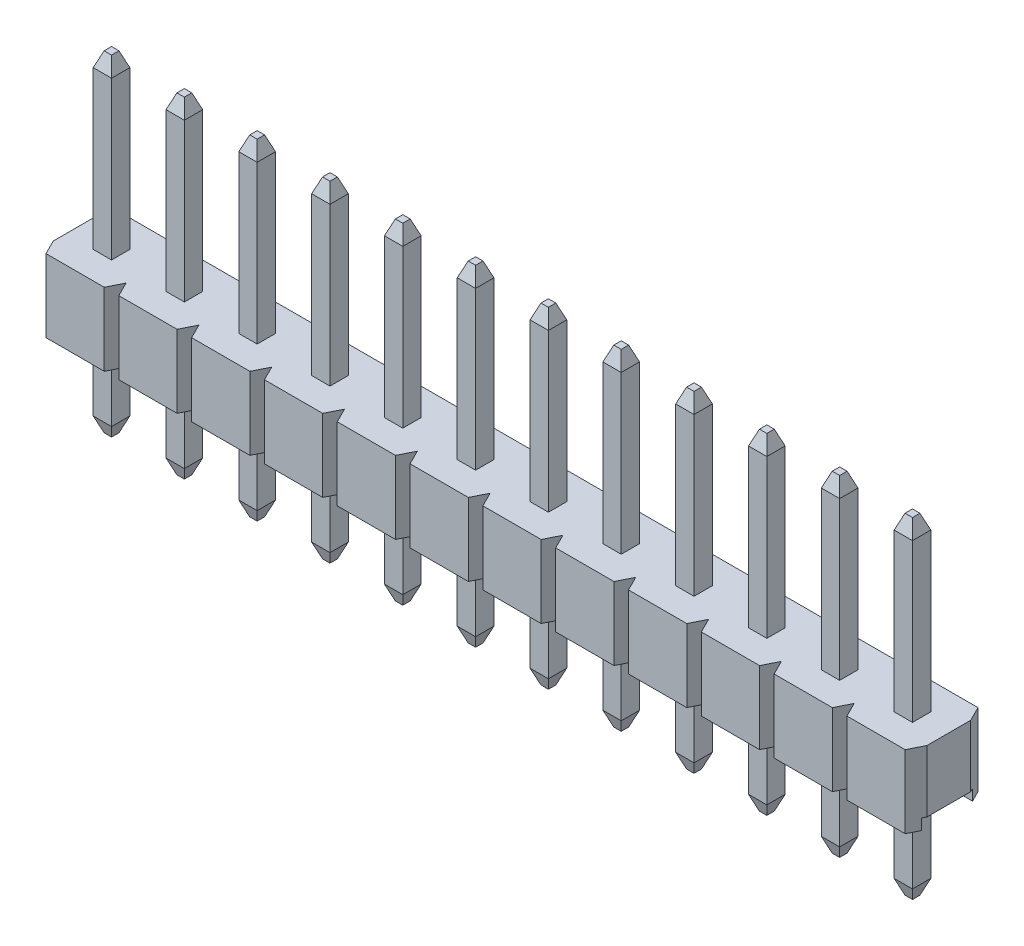
from build123d import *
from OCP.BRepFilletAPI import BRepFilletAPI_MakeChamfer

# Parameters (mm, degrees)
SKETCH1_W                     = 2.54
SKETCH1_H                     = 2.54
MAIN_BODY_DEPTH               = 2.54
SKETCH3_W                     = 1.778
SKETCH3_H                     = 0.381
CUT_EXTRUDE1_DEPTH            = 5.399409051
CUT_EXTRUDE2_DEPTH            = 5.399409051
BODY_PATTERN_COUNT            = 12
BODY_PATTERN_PITCH            = 2.54
PIN_START                     = -5.54
SKETCH2_W                     = 0.64
SKETCH2_H                     = 0.64
PIN_DEPTH                     = 11.54
CHAMFER1_SIZE                 = 0.508
CHAMFER1_SIZE2                = 0.1905
CHAMFER2_SIZE                 = 0.1905
CHAMFER2_SIZE2                = 0.508
PIN_PATTERN_COUNT             = 12
PIN_PATTERN_PITCH             = 2.54
CHAMFER1_OF_PIN_PATTERN_SIZE  = 0.508
CHAMFER1_OF_PIN_PATTERN_SIZE2 = 0.1905
CHAMFER2_OF_PIN_PATTERN_SIZE2 = 0.1905
CHAMFER2_OF_PIN_PATTERN_SIZE  = 0.508


with BuildPart() as part:
    # Sketch1 → Main Body (new body)
    with BuildSketch(Plane(origin=(0, 0, 0), x_dir=(1, 0, 0), z_dir=(0, 1, 0))):
        with Locations((1.27, 1.27)):
            Rectangle(SKETCH1_W, SKETCH1_H)
    main_body = extrude(amount=MAIN_BODY_DEPTH)

    # Sketch3 → Cut-Extrude1 (cut, through all)
    with BuildSketch(Plane.ZY):
        with Locations((-1.27, 0.1905)):
            Rectangle(SKETCH3_W, SKETCH3_H)
    cut_extrude1 = extrude(amount=-CUT_EXTRUDE1_DEPTH, mode=Mode.SUBTRACT)

    # Sketch4 → Cut-Extrude2 (cut, through all)
    with BuildSketch(Plane(origin=(0, 2.54, 0), x_dir=(1, 0, 0), z_dir=(0, 1, 0))):
        Polygon((0.254, 2.54), (0, 2.54), (0, 2.032), align=None)
        Polygon((2.54, 2.54), (2.286, 2.54), (2.54, 2.032), align=None)
        Polygon((0.254, 0), (0, 0.508), (0, 0), align=None)
        Polygon((2.54, 0), (2.286, 0), (2.54, 0.508), align=None)
    cut_extrude2 = extrude(amount=-CUT_EXTRUDE2_DEPTH, mode=Mode.SUBTRACT)

    # Body Pattern: Main Body, Cut-Extrude1, Cut-Extrude2 ×12
    with Locations(*[(-i * BODY_PATTERN_PITCH, 0, 0) for i in range(1, BODY_PATTERN_COUNT)]):
        add(main_body)
        add(cut_extrude1, mode=Mode.SUBTRACT)
        add(cut_extrude2, mode=Mode.SUBTRACT)

    # Sketch2 → Pin (add)
    with BuildSketch(Plane(origin=(0, 2.54, 0), x_dir=(1, 0, 0), z_dir=(0, 1, 0)).offset(PIN_START)):
        with Locations((1.27, 1.27)):
            Rectangle(SKETCH2_W, SKETCH2_H)
    pin = extrude(amount=PIN_DEPTH)

    # Chamfer1: one chamfer whose edges measure the first distance from different faces: ONE call of the kernel's chamfer builder (chamfer() names one face for all edges)
    chamfer1_edges_1 = [part.edges().sort_by_distance(p)[0] for p in [
        (0.95, 8.54, -1.27),
    ]]
    chamfer1_side_1 = [part.faces().sort_by_distance(p)[0] for p in [
        (0.95, 5.54, -1.27),
    ]]
    chamfer1_edges_2 = [part.edges().sort_by_distance(p)[0] for p in [
        (1.27, 8.54, -0.95),
    ]]
    chamfer1_side_2 = [part.faces().sort_by_distance(p)[0] for p in [
        (1.27, 5.54, -0.95),
    ]]
    chamfer1_edges_3 = [part.edges().sort_by_distance(p)[0] for p in [
        (1.59, 8.54, -1.27),
    ]]
    chamfer1_side_3 = [part.faces().sort_by_distance(p)[0] for p in [
        (1.59, 5.54, -1.27),
    ]]
    chamfer1_edges_4 = [part.edges().sort_by_distance(p)[0] for p in [
        (1.27, 8.54, -1.59),
    ]]
    chamfer1_side_4 = [part.faces().sort_by_distance(p)[0] for p in [
        (1.27, 5.54, -1.59),
    ]]
    chamfer1 = BRepFilletAPI_MakeChamfer(part.part.solid().wrapped)
    for e in chamfer1_edges_1:
        chamfer1.Add(CHAMFER1_SIZE, CHAMFER1_SIZE2, e.wrapped, chamfer1_side_1[0].wrapped)  # the first distance lies on this face
    for e in chamfer1_edges_2:
        chamfer1.Add(CHAMFER1_SIZE, CHAMFER1_SIZE2, e.wrapped, chamfer1_side_2[0].wrapped)  # the first distance lies on this face
    for e in chamfer1_edges_3:
        chamfer1.Add(CHAMFER1_SIZE, CHAMFER1_SIZE2, e.wrapped, chamfer1_side_3[0].wrapped)  # the first distance lies on this face
    for e in chamfer1_edges_4:
        chamfer1.Add(CHAMFER1_SIZE, CHAMFER1_SIZE2, e.wrapped, chamfer1_side_4[0].wrapped)  # the first distance lies on this face
    add(Compound.cast(chamfer1.Shape()), mode=Mode.REPLACE)

    # Chamfer2
    chamfer2_edges = [part.edges().sort_by_distance(p)[0] for p in [
        (1.27, -3, -0.95),
        (1.59, -3, -1.27),
        (1.27, -3, -1.59),
        (0.95, -3, -1.27),
    ]]
    chamfer2_side = [part.faces().sort_by_distance(p)[0] for p in [
        (1.27, -3, -1.27),
    ]]
    chamfer(chamfer2_edges, length=CHAMFER2_SIZE, length2=CHAMFER2_SIZE2, reference=chamfer2_side[0])

    # Pin Pattern: Pin ×12
    with Locations(*[(-i * PIN_PATTERN_PITCH, 0, 0) for i in range(1, PIN_PATTERN_COUNT)]):
        add(pin)

    # Chamfer1 of Pin Pattern: one chamfer whose edges measure the first distance from different faces: ONE call of the kernel's chamfer builder (chamfer() names one face for all edges)
    chamfer1_of_pin_pattern_edges_1 = [part.edges().sort_by_distance(p)[0] for p in [
        (-1.59, 8.54, -1.27),
    ]]
    chamfer1_of_pin_pattern_side_1 = [part.faces().sort_by_distance(p)[0] for p in [
        (-1.59, 5.54, -1.27),
    ]]
    chamfer1_of_pin_pattern_edges_2 = [part.edges().sort_by_distance(p)[0] for p in [
        (-1.27, 8.54, -0.95),
    ]]
    chamfer1_of_pin_pattern_side_2 = [part.faces().sort_by_distance(p)[0] for p in [
        (-1.27, 5.54, -0.95),
    ]]
    chamfer1_of_pin_pattern_edges_3 = [part.edges().sort_by_distance(p)[0] for p in [
        (-0.95, 8.54, -1.27),
    ]]
    chamfer1_of_pin_pattern_side_3 = [part.faces().sort_by_distance(p)[0] for p in [
        (-0.95, 5.54, -1.27),
    ]]
    chamfer1_of_pin_pattern_edges_4 = [part.edges().sort_by_distance(p)[0] for p in [
        (-1.27, 8.54, -1.59),
    ]]
    chamfer1_of_pin_pattern_side_4 = [part.faces().sort_by_distance(p)[0] for p in [
        (-1.27, 5.54, -1.59),
    ]]
    chamfer1_of_pin_pattern_edges_5 = [part.edges().sort_by_distance(p)[0] for p in [
        (-4.13, 8.54, -1.27),
    ]]
    chamfer1_of_pin_pattern_side_5 = [part.faces().sort_by_distance(p)[0] for p in [
        (-4.13, 5.54, -1.27),
    ]]
    chamfer1_of_pin_pattern_edges_6 = [part.edges().sort_by_distance(p)[0] for p in [
        (-3.81, 8.54, -0.95),
    ]]
    chamfer1_of_pin_pattern_side_6 = [part.faces().sort_by_distance(p)[0] for p in [
        (-3.81, 5.54, -0.95),
    ]]
    chamfer1_of_pin_pattern_edges_7 = [part.edges().sort_by_distance(p)[0] for p in [
        (-3.49, 8.54, -1.27),
    ]]
    chamfer1_of_pin_pattern_side_7 = [part.faces().sort_by_distance(p)[0] for p in [
        (-3.49, 5.54, -1.27),
    ]]
    chamfer1_of_pin_pattern_edges_8 = [part.edges().sort_by_distance(p)[0] for p in [
        (-3.81, 8.54, -1.59),
    ]]
    chamfer1_of_pin_pattern_side_8 = [part.faces().sort_by_distance(p)[0] for p in [
        (-3.81, 5.54, -1.59),
    ]]
    chamfer1_of_pin_pattern_edges_9 = [part.edges().sort_by_distance(p)[0] for p in [
        (-6.67, 8.54, -1.27),
    ]]
    chamfer1_of_pin_pattern_side_9 = [part.faces().sort_by_distance(p)[0] for p in [
        (-6.67, 5.54, -1.27),
    ]]
    chamfer1_of_pin_pattern_edges_10 = [part.edges().sort_by_distance(p)[0] for p in [
        (-6.35, 8.54, -0.95),
    ]]
    chamfer1_of_pin_pattern_side_10 = [part.faces().sort_by_distance(p)[0] for p in [
        (-6.35, 5.54, -0.95),
    ]]
    chamfer1_of_pin_pattern_edges_11 = [part.edges().sort_by_distance(p)[0] for p in [
        (-6.03, 8.54, -1.27),
    ]]
    chamfer1_of_pin_pattern_side_11 = [part.faces().sort_by_distance(p)[0] for p in [
        (-6.03, 5.54, -1.27),
    ]]
    chamfer1_of_pin_pattern_edges_12 = [part.edges().sort_by_distance(p)[0] for p in [
        (-6.35, 8.54, -1.59),
    ]]
    chamfer1_of_pin_pattern_side_12 = [part.faces().sort_by_distance(p)[0] for p in [
        (-6.35, 5.54, -1.59),
    ]]
    chamfer1_of_pin_pattern_edges_13 = [part.edges().sort_by_distance(p)[0] for p in [
        (-9.21, 8.54, -1.27),
    ]]
    chamfer1_of_pin_pattern_side_13 = [part.faces().sort_by_distance(p)[0] for p in [
        (-9.21, 5.54, -1.27),
    ]]
    chamfer1_of_pin_pattern_edges_14 = [part.edges().sort_by_distance(p)[0] for p in [
        (-8.89, 8.54, -0.95),
    ]]
    chamfer1_of_pin_pattern_side_14 = [part.faces().sort_by_distance(p)[0] for p in [
        (-8.89, 5.54, -0.95),
    ]]
    chamfer1_of_pin_pattern_edges_15 = [part.edges().sort_by_distance(p)[0] for p in [
        (-8.57, 8.54, -1.27),
    ]]
    chamfer1_of_pin_pattern_side_15 = [part.faces().sort_by_distance(p)[0] for p in [
        (-8.57, 5.54, -1.27),
    ]]
    chamfer1_of_pin_pattern_edges_16 = [part.edges().sort_by_distance(p)[0] for p in [
        (-8.89, 8.54, -1.59),
    ]]
    chamfer1_of_pin_pattern_side_16 = [part.faces().sort_by_distance(p)[0] for p in [
        (-8.89, 5.54, -1.59),
    ]]
    chamfer1_of_pin_pattern_edges_17 = [part.edges().sort_by_distance(p)[0] for p in [
        (-11.75, 8.54, -1.27),
    ]]
    chamfer1_of_pin_pattern_side_17 = [part.faces().sort_by_distance(p)[0] for p in [
        (-11.75, 5.54, -1.27),
    ]]
    chamfer1_of_pin_pattern_edges_18 = [part.edges().sort_by_distance(p)[0] for p in [
        (-11.43, 8.54, -0.95),
    ]]
    chamfer1_of_pin_pattern_side_18 = [part.faces().sort_by_distance(p)[0] for p in [
        (-11.43, 5.54, -0.95),
    ]]
    chamfer1_of_pin_pattern_edges_19 = [part.edges().sort_by_distance(p)[0] for p in [
        (-11.11, 8.54, -1.27),
    ]]
    chamfer1_of_pin_pattern_side_19 = [part.faces().sort_by_distance(p)[0] for p in [
        (-11.11, 5.54, -1.27),
    ]]
    chamfer1_of_pin_pattern_edges_20 = [part.edges().sort_by_distance(p)[0] for p in [
        (-11.43, 8.54, -1.59),
    ]]
    chamfer1_of_pin_pattern_side_20 = [part.faces().sort_by_distance(p)[0] for p in [
        (-11.43, 5.54, -1.59),
    ]]
    chamfer1_of_pin_pattern_edges_21 = [part.edges().sort_by_distance(p)[0] for p in [
        (-14.29, 8.54, -1.27),
    ]]
    chamfer1_of_pin_pattern_side_21 = [part.faces().sort_by_distance(p)[0] for p in [
        (-14.29, 5.54, -1.27),
    ]]
    chamfer1_of_pin_pattern_edges_22 = [part.edges().sort_by_distance(p)[0] for p in [
        (-13.97, 8.54, -0.95),
    ]]
    chamfer1_of_pin_pattern_side_22 = [part.faces().sort_by_distance(p)[0] for p in [
        (-13.97, 5.54, -0.95),
    ]]
    chamfer1_of_pin_pattern_edges_23 = [part.edges().sort_by_distance(p)[0] for p in [
        (-13.65, 8.54, -1.27),
    ]]
    chamfer1_of_pin_pattern_side_23 = [part.faces().sort_by_distance(p)[0] for p in [
        (-13.65, 5.54, -1.27),
    ]]
    chamfer1_of_pin_pattern_edges_24 = [part.edges().sort_by_distance(p)[0] for p in [
        (-13.97, 8.54, -1.59),
    ]]
    chamfer1_of_pin_pattern_side_24 = [part.faces().sort_by_distance(p)[0] for p in [
        (-13.97, 5.54, -1.59),
    ]]
    chamfer1_of_pin_pattern_edges_25 = [part.edges().sort_by_distance(p)[0] for p in [
        (-16.83, 8.54, -1.27),
    ]]
    chamfer1_of_pin_pattern_side_25 = [part.faces().sort_by_distance(p)[0] for p in [
        (-16.83, 5.54, -1.27),
    ]]
    chamfer1_of_pin_pattern_edges_26 = [part.edges().sort_by_distance(p)[0] for p in [
        (-16.51, 8.54, -0.95),
    ]]
    chamfer1_of_pin_pattern_side_26 = [part.faces().sort_by_distance(p)[0] for p in [
        (-16.51, 5.54, -0.95),
    ]]
    chamfer1_of_pin_pattern_edges_27 = [part.edges().sort_by_distance(p)[0] for p in [
        (-16.19, 8.54, -1.27),
    ]]
    chamfer1_of_pin_pattern_side_27 = [part.faces().sort_by_distance(p)[0] for p in [
        (-16.19, 5.54, -1.27),
    ]]
    chamfer1_of_pin_pattern_edges_28 = [part.edges().sort_by_distance(p)[0] for p in [
        (-16.51, 8.54, -1.59),
    ]]
    chamfer1_of_pin_pattern_side_28 = [part.faces().sort_by_distance(p)[0] for p in [
        (-16.51, 5.54, -1.59),
    ]]
    chamfer1_of_pin_pattern_edges_29 = [part.edges().sort_by_distance(p)[0] for p in [
        (-19.37, 8.54, -1.27),
    ]]
    chamfer1_of_pin_pattern_side_29 = [part.faces().sort_by_distance(p)[0] for p in [
        (-19.37, 5.54, -1.27),
    ]]
    chamfer1_of_pin_pattern_edges_30 = [part.edges().sort_by_distance(p)[0] for p in [
        (-19.05, 8.54, -0.95),
    ]]
    chamfer1_of_pin_pattern_side_30 = [part.faces().sort_by_distance(p)[0] for p in [
        (-19.05, 5.54, -0.95),
    ]]
    chamfer1_of_pin_pattern_edges_31 = [part.edges().sort_by_distance(p)[0] for p in [
        (-18.73, 8.54, -1.27),
    ]]
    chamfer1_of_pin_pattern_side_31 = [part.faces().sort_by_distance(p)[0] for p in [
        (-18.73, 5.54, -1.27),
    ]]
    chamfer1_of_pin_pattern_edges_32 = [part.edges().sort_by_distance(p)[0] for p in [
        (-19.05, 8.54, -1.59),
    ]]
    chamfer1_of_pin_pattern_side_32 = [part.faces().sort_by_distance(p)[0] for p in [
        (-19.05, 5.54, -1.59),
    ]]
    chamfer1_of_pin_pattern_edges_33 = [part.edges().sort_by_distance(p)[0] for p in [
        (-21.91, 8.54, -1.27),
    ]]
    chamfer1_of_pin_pattern_side_33 = [part.faces().sort_by_distance(p)[0] for p in [
        (-21.91, 5.54, -1.27),
    ]]
    chamfer1_of_pin_pattern_edges_34 = [part.edges().sort_by_distance(p)[0] for p in [
        (-21.59, 8.54, -0.95),
    ]]
    chamfer1_of_pin_pattern_side_34 = [part.faces().sort_by_distance(p)[0] for p in [
        (-21.59, 5.54, -0.95),
    ]]
    chamfer1_of_pin_pattern_edges_35 = [part.edges().sort_by_distance(p)[0] for p in [
        (-21.27, 8.54, -1.27),
    ]]
    chamfer1_of_pin_pattern_side_35 = [part.faces().sort_by_distance(p)[0] for p in [
        (-21.27, 5.54, -1.27),
    ]]
    chamfer1_of_pin_pattern_edges_36 = [part.edges().sort_by_distance(p)[0] for p in [
        (-21.59, 8.54, -1.59),
    ]]
    chamfer1_of_pin_pattern_side_36 = [part.faces().sort_by_distance(p)[0] for p in [
        (-21.59, 5.54, -1.59),
    ]]
    chamfer1_of_pin_pattern_edges_37 = [part.edges().sort_by_distance(p)[0] for p in [
        (-24.45, 8.54, -1.27),
    ]]
    chamfer1_of_pin_pattern_side_37 = [part.faces().sort_by_distance(p)[0] for p in [
        (-24.45, 5.54, -1.27),
    ]]
    chamfer1_of_pin_pattern_edges_38 = [part.edges().sort_by_distance(p)[0] for p in [
        (-24.13, 8.54, -0.95),
    ]]
    chamfer1_of_pin_pattern_side_38 = [part.faces().sort_by_distance(p)[0] for p in [
        (-24.13, 5.54, -0.95),
    ]]
    chamfer1_of_pin_pattern_edges_39 = [part.edges().sort_by_distance(p)[0] for p in [
        (-23.81, 8.54, -1.27),
    ]]
    chamfer1_of_pin_pattern_side_39 = [part.faces().sort_by_distance(p)[0] for p in [
        (-23.81, 5.54, -1.27),
    ]]
    chamfer1_of_pin_pattern_edges_40 = [part.edges().sort_by_distance(p)[0] for p in [
        (-24.13, 8.54, -1.59),
    ]]
    chamfer1_of_pin_pattern_side_40 = [part.faces().sort_by_distance(p)[0] for p in [
        (-24.13, 5.54, -1.59),
    ]]
    chamfer1_of_pin_pattern_edges_41 = [part.edges().sort_by_distance(p)[0] for p in [
        (-26.99, 8.54, -1.27),
    ]]
    chamfer1_of_pin_pattern_side_41 = [part.faces().sort_by_distance(p)[0] for p in [
        (-26.99, 5.54, -1.27),
    ]]
    chamfer1_of_pin_pattern_edges_42 = [part.edges().sort_by_distance(p)[0] for p in [
        (-26.67, 8.54, -0.95),
    ]]
    chamfer1_of_pin_pattern_side_42 = [part.faces().sort_by_distance(p)[0] for p in [
        (-26.67, 5.54, -0.95),
    ]]
    chamfer1_of_pin_pattern_edges_43 = [part.edges().sort_by_distance(p)[0] for p in [
        (-26.35, 8.54, -1.27),
    ]]
    chamfer1_of_pin_pattern_side_43 = [part.faces().sort_by_distance(p)[0] for p in [
        (-26.35, 5.54, -1.27),
    ]]
    chamfer1_of_pin_pattern_edges_44 = [part.edges().sort_by_distance(p)[0] for p in [
        (-26.67, 8.54, -1.59),
    ]]
    chamfer1_of_pin_pattern_side_44 = [part.faces().sort_by_distance(p)[0] for p in [
        (-26.67, 5.54, -1.59),
    ]]
    chamfer1_of_pin_pattern = BRepFilletAPI_MakeChamfer(part.part.solid().wrapped)
    for e in chamfer1_of_pin_pattern_edges_1:
        chamfer1_of_pin_pattern.Add(CHAMFER1_OF_PIN_PATTERN_SIZE, CHAMFER1_OF_PIN_PATTERN_SIZE2, e.wrapped, chamfer1_of_pin_pattern_side_1[0].wrapped)  # the first distance lies on this face
    for e in chamfer1_of_pin_pattern_edges_2:
        chamfer1_of_pin_pattern.Add(CHAMFER1_OF_PIN_PATTERN_SIZE, CHAMFER1_OF_PIN_PATTERN_SIZE2, e.wrapped, chamfer1_of_pin_pattern_side_2[0].wrapped)  # the first distance lies on this face
    for e in chamfer1_of_pin_pattern_edges_3:
        chamfer1_of_pin_pattern.Add(CHAMFER1_OF_PIN_PATTERN_SIZE, CHAMFER1_OF_PIN_PATTERN_SIZE2, e.wrapped, chamfer1_of_pin_pattern_side_3[0].wrapped)  # the first distance lies on this face
    for e in chamfer1_of_pin_pattern_edges_4:
        chamfer1_of_pin_pattern.Add(CHAMFER1_OF_PIN_PATTERN_SIZE, CHAMFER1_OF_PIN_PATTERN_SIZE2, e.wrapped, chamfer1_of_pin_pattern_side_4[0].wrapped)  # the first distance lies on this face
    for e in chamfer1_of_pin_pattern_edges_5:
        chamfer1_of_pin_pattern.Add(CHAMFER1_OF_PIN_PATTERN_SIZE, CHAMFER1_OF_PIN_PATTERN_SIZE2, e.wrapped, chamfer1_of_pin_pattern_side_5[0].wrapped)  # the first distance lies on this face
    for e in chamfer1_of_pin_pattern_edges_6:
        chamfer1_of_pin_pattern.Add(CHAMFER1_OF_PIN_PATTERN_SIZE, CHAMFER1_OF_PIN_PATTERN_SIZE2, e.wrapped, chamfer1_of_pin_pattern_side_6[0].wrapped)  # the first distance lies on this face
    for e in chamfer1_of_pin_pattern_edges_7:
        chamfer1_of_pin_pattern.Add(CHAMFER1_OF_PIN_PATTERN_SIZE, CHAMFER1_OF_PIN_PATTERN_SIZE2, e.wrapped, chamfer1_of_pin_pattern_side_7[0].wrapped)  # the first distance lies on this face
    for e in chamfer1_of_pin_pattern_edges_8:
        chamfer1_of_pin_pattern.Add(CHAMFER1_OF_PIN_PATTERN_SIZE, CHAMFER1_OF_PIN_PATTERN_SIZE2, e.wrapped, chamfer1_of_pin_pattern_side_8[0].wrapped)  # the first distance lies on this face
    for e in chamfer1_of_pin_pattern_edges_9:
        chamfer1_of_pin_pattern.Add(CHAMFER1_OF_PIN_PATTERN_SIZE, CHAMFER1_OF_PIN_PATTERN_SIZE2, e.wrapped, chamfer1_of_pin_pattern_side_9[0].wrapped)  # the first distance lies on this face
    for e in chamfer1_of_pin_pattern_edges_10:
        chamfer1_of_pin_pattern.Add(CHAMFER1_OF_PIN_PATTERN_SIZE, CHAMFER1_OF_PIN_PATTERN_SIZE2, e.wrapped, chamfer1_of_pin_pattern_side_10[0].wrapped)  # the first distance lies on this face
    for e in chamfer1_of_pin_pattern_edges_11:
        chamfer1_of_pin_pattern.Add(CHAMFER1_OF_PIN_PATTERN_SIZE, CHAMFER1_OF_PIN_PATTERN_SIZE2, e.wrapped, chamfer1_of_pin_pattern_side_11[0].wrapped)  # the first distance lies on this face
    for e in chamfer1_of_pin_pattern_edges_12:
        chamfer1_of_pin_pattern.Add(CHAMFER1_OF_PIN_PATTERN_SIZE, CHAMFER1_OF_PIN_PATTERN_SIZE2, e.wrapped, chamfer1_of_pin_pattern_side_12[0].wrapped)  # the first distance lies on this face
    for e in chamfer1_of_pin_pattern_edges_13:
        chamfer1_of_pin_pattern.Add(CHAMFER1_OF_PIN_PATTERN_SIZE, CHAMFER1_OF_PIN_PATTERN_SIZE2, e.wrapped, chamfer1_of_pin_pattern_side_13[0].wrapped)  # the first distance lies on this face
    for e in chamfer1_of_pin_pattern_edges_14:
        chamfer1_of_pin_pattern.Add(CHAMFER1_OF_PIN_PATTERN_SIZE, CHAMFER1_OF_PIN_PATTERN_SIZE2, e.wrapped, chamfer1_of_pin_pattern_side_14[0].wrapped)  # the first distance lies on this face
    for e in chamfer1_of_pin_pattern_edges_15:
        chamfer1_of_pin_pattern.Add(CHAMFER1_OF_PIN_PATTERN_SIZE, CHAMFER1_OF_PIN_PATTERN_SIZE2, e.wrapped, chamfer1_of_pin_pattern_side_15[0].wrapped)  # the first distance lies on this face
    for e in chamfer1_of_pin_pattern_edges_16:
        chamfer1_of_pin_pattern.Add(CHAMFER1_OF_PIN_PATTERN_SIZE, CHAMFER1_OF_PIN_PATTERN_SIZE2, e.wrapped, chamfer1_of_pin_pattern_side_16[0].wrapped)  # the first distance lies on this face
    for e in chamfer1_of_pin_pattern_edges_17:
        chamfer1_of_pin_pattern.Add(CHAMFER1_OF_PIN_PATTERN_SIZE, CHAMFER1_OF_PIN_PATTERN_SIZE2, e.wrapped, chamfer1_of_pin_pattern_side_17[0].wrapped)  # the first distance lies on this face
    for e in chamfer1_of_pin_pattern_edges_18:
        chamfer1_of_pin_pattern.Add(CHAMFER1_OF_PIN_PATTERN_SIZE, CHAMFER1_OF_PIN_PATTERN_SIZE2, e.wrapped, chamfer1_of_pin_pattern_side_18[0].wrapped)  # the first distance lies on this face
    for e in chamfer1_of_pin_pattern_edges_19:
        chamfer1_of_pin_pattern.Add(CHAMFER1_OF_PIN_PATTERN_SIZE, CHAMFER1_OF_PIN_PATTERN_SIZE2, e.wrapped, chamfer1_of_pin_pattern_side_19[0].wrapped)  # the first distance lies on this face
    for e in chamfer1_of_pin_pattern_edges_20:
        chamfer1_of_pin_pattern.Add(CHAMFER1_OF_PIN_PATTERN_SIZE, CHAMFER1_OF_PIN_PATTERN_SIZE2, e.wrapped, chamfer1_of_pin_pattern_side_20[0].wrapped)  # the first distance lies on this face
    for e in chamfer1_of_pin_pattern_edges_21:
        chamfer1_of_pin_pattern.Add(CHAMFER1_OF_PIN_PATTERN_SIZE, CHAMFER1_OF_PIN_PATTERN_SIZE2, e.wrapped, chamfer1_of_pin_pattern_side_21[0].wrapped)  # the first distance lies on this face
    for e in chamfer1_of_pin_pattern_edges_22:
        chamfer1_of_pin_pattern.Add(CHAMFER1_OF_PIN_PATTERN_SIZE, CHAMFER1_OF_PIN_PATTERN_SIZE2, e.wrapped, chamfer1_of_pin_pattern_side_22[0].wrapped)  # the first distance lies on this face
    for e in chamfer1_of_pin_pattern_edges_23:
        chamfer1_of_pin_pattern.Add(CHAMFER1_OF_PIN_PATTERN_SIZE, CHAMFER1_OF_PIN_PATTERN_SIZE2, e.wrapped, chamfer1_of_pin_pattern_side_23[0].wrapped)  # the first distance lies on this face
    for e in chamfer1_of_pin_pattern_edges_24:
        chamfer1_of_pin_pattern.Add(CHAMFER1_OF_PIN_PATTERN_SIZE, CHAMFER1_OF_PIN_PATTERN_SIZE2, e.wrapped, chamfer1_of_pin_pattern_side_24[0].wrapped)  # the first distance lies on this face
    for e in chamfer1_of_pin_pattern_edges_25:
        chamfer1_of_pin_pattern.Add(CHAMFER1_OF_PIN_PATTERN_SIZE, CHAMFER1_OF_PIN_PATTERN_SIZE2, e.wrapped, chamfer1_of_pin_pattern_side_25[0].wrapped)  # the first distance lies on this face
    for e in chamfer1_of_pin_pattern_edges_26:
        chamfer1_of_pin_pattern.Add(CHAMFER1_OF_PIN_PATTERN_SIZE, CHAMFER1_OF_PIN_PATTERN_SIZE2, e.wrapped, chamfer1_of_pin_pattern_side_26[0].wrapped)  # the first distance lies on this face
    for e in chamfer1_of_pin_pattern_edges_27:
        chamfer1_of_pin_pattern.Add(CHAMFER1_OF_PIN_PATTERN_SIZE, CHAMFER1_OF_PIN_PATTERN_SIZE2, e.wrapped, chamfer1_of_pin_pattern_side_27[0].wrapped)  # the first distance lies on this face
    for e in chamfer1_of_pin_pattern_edges_28:
        chamfer1_of_pin_pattern.Add(CHAMFER1_OF_PIN_PATTERN_SIZE, CHAMFER1_OF_PIN_PATTERN_SIZE2, e.wrapped, chamfer1_of_pin_pattern_side_28[0].wrapped)  # the first distance lies on this face
    for e in chamfer1_of_pin_pattern_edges_29:
        chamfer1_of_pin_pattern.Add(CHAMFER1_OF_PIN_PATTERN_SIZE, CHAMFER1_OF_PIN_PATTERN_SIZE2, e.wrapped, chamfer1_of_pin_pattern_side_29[0].wrapped)  # the first distance lies on this face
    for e in chamfer1_of_pin_pattern_edges_30:
        chamfer1_of_pin_pattern.Add(CHAMFER1_OF_PIN_PATTERN_SIZE, CHAMFER1_OF_PIN_PATTERN_SIZE2, e.wrapped, chamfer1_of_pin_pattern_side_30[0].wrapped)  # the first distance lies on this face
    for e in chamfer1_of_pin_pattern_edges_31:
        chamfer1_of_pin_pattern.Add(CHAMFER1_OF_PIN_PATTERN_SIZE, CHAMFER1_OF_PIN_PATTERN_SIZE2, e.wrapped, chamfer1_of_pin_pattern_side_31[0].wrapped)  # the first distance lies on this face
    for e in chamfer1_of_pin_pattern_edges_32:
        chamfer1_of_pin_pattern.Add(CHAMFER1_OF_PIN_PATTERN_SIZE, CHAMFER1_OF_PIN_PATTERN_SIZE2, e.wrapped, chamfer1_of_pin_pattern_side_32[0].wrapped)  # the first distance lies on this face
    for e in chamfer1_of_pin_pattern_edges_33:
        chamfer1_of_pin_pattern.Add(CHAMFER1_OF_PIN_PATTERN_SIZE, CHAMFER1_OF_PIN_PATTERN_SIZE2, e.wrapped, chamfer1_of_pin_pattern_side_33[0].wrapped)  # the first distance lies on this face
    for e in chamfer1_of_pin_pattern_edges_34:
        chamfer1_of_pin_pattern.Add(CHAMFER1_OF_PIN_PATTERN_SIZE, CHAMFER1_OF_PIN_PATTERN_SIZE2, e.wrapped, chamfer1_of_pin_pattern_side_34[0].wrapped)  # the first distance lies on this face
    for e in chamfer1_of_pin_pattern_edges_35:
        chamfer1_of_pin_pattern.Add(CHAMFER1_OF_PIN_PATTERN_SIZE, CHAMFER1_OF_PIN_PATTERN_SIZE2, e.wrapped, chamfer1_of_pin_pattern_side_35[0].wrapped)  # the first distance lies on this face
    for e in chamfer1_of_pin_pattern_edges_36:
        chamfer1_of_pin_pattern.Add(CHAMFER1_OF_PIN_PATTERN_SIZE, CHAMFER1_OF_PIN_PATTERN_SIZE2, e.wrapped, chamfer1_of_pin_pattern_side_36[0].wrapped)  # the first distance lies on this face
    for e in chamfer1_of_pin_pattern_edges_37:
        chamfer1_of_pin_pattern.Add(CHAMFER1_OF_PIN_PATTERN_SIZE, CHAMFER1_OF_PIN_PATTERN_SIZE2, e.wrapped, chamfer1_of_pin_pattern_side_37[0].wrapped)  # the first distance lies on this face
    for e in chamfer1_of_pin_pattern_edges_38:
        chamfer1_of_pin_pattern.Add(CHAMFER1_OF_PIN_PATTERN_SIZE, CHAMFER1_OF_PIN_PATTERN_SIZE2, e.wrapped, chamfer1_of_pin_pattern_side_38[0].wrapped)  # the first distance lies on this face
    for e in chamfer1_of_pin_pattern_edges_39:
        chamfer1_of_pin_pattern.Add(CHAMFER1_OF_PIN_PATTERN_SIZE, CHAMFER1_OF_PIN_PATTERN_SIZE2, e.wrapped, chamfer1_of_pin_pattern_side_39[0].wrapped)  # the first distance lies on this face
    for e in chamfer1_of_pin_pattern_edges_40:
        chamfer1_of_pin_pattern.Add(CHAMFER1_OF_PIN_PATTERN_SIZE, CHAMFER1_OF_PIN_PATTERN_SIZE2, e.wrapped, chamfer1_of_pin_pattern_side_40[0].wrapped)  # the first distance lies on this face
    for e in chamfer1_of_pin_pattern_edges_41:
        chamfer1_of_pin_pattern.Add(CHAMFER1_OF_PIN_PATTERN_SIZE, CHAMFER1_OF_PIN_PATTERN_SIZE2, e.wrapped, chamfer1_of_pin_pattern_side_41[0].wrapped)  # the first distance lies on this face
    for e in chamfer1_of_pin_pattern_edges_42:
        chamfer1_of_pin_pattern.Add(CHAMFER1_OF_PIN_PATTERN_SIZE, CHAMFER1_OF_PIN_PATTERN_SIZE2, e.wrapped, chamfer1_of_pin_pattern_side_42[0].wrapped)  # the first distance lies on this face
    for e in chamfer1_of_pin_pattern_edges_43:
        chamfer1_of_pin_pattern.Add(CHAMFER1_OF_PIN_PATTERN_SIZE, CHAMFER1_OF_PIN_PATTERN_SIZE2, e.wrapped, chamfer1_of_pin_pattern_side_43[0].wrapped)  # the first distance lies on this face
    for e in chamfer1_of_pin_pattern_edges_44:
        chamfer1_of_pin_pattern.Add(CHAMFER1_OF_PIN_PATTERN_SIZE, CHAMFER1_OF_PIN_PATTERN_SIZE2, e.wrapped, chamfer1_of_pin_pattern_side_44[0].wrapped)  # the first distance lies on this face
    add(Compound.cast(chamfer1_of_pin_pattern.Shape()), mode=Mode.REPLACE)

    # Chamfer2 of Pin Pattern
    chamfer2_of_pin_pattern_edges = [part.edges().sort_by_distance(p)[0] for p in [
        (-1.27, -3, -0.95),
        (-0.95, -3, -1.27),
        (-1.27, -3, -1.59),
        (-1.59, -3, -1.27),
        (-3.81, -3, -0.95),
        (-3.49, -3, -1.27),
        (-3.81, -3, -1.59),
        (-4.13, -3, -1.27),
        (-6.35, -3, -0.95),
        (-6.03, -3, -1.27),
        (-6.35, -3, -1.59),
        (-6.67, -3, -1.27),
        (-8.89, -3, -0.95),
        (-8.57, -3, -1.27),
        (-8.89, -3, -1.59),
        (-9.21, -3, -1.27),
        (-11.43, -3, -0.95),
        (-11.11, -3, -1.27),
        (-11.43, -3, -1.59),
        (-11.75, -3, -1.27),
        (-13.97, -3, -0.95),
        (-13.65, -3, -1.27),
        (-13.97, -3, -1.59),
        (-14.29, -3, -1.27),
        (-16.51, -3, -0.95),
        (-16.19, -3, -1.27),
        (-16.51, -3, -1.59),
        (-16.83, -3, -1.27),
        (-19.05, -3, -0.95),
        (-18.73, -3, -1.27),
        (-19.05, -3, -1.59),
        (-19.37, -3, -1.27),
        (-21.59, -3, -0.95),
        (-21.27, -3, -1.27),
        (-21.59, -3, -1.59),
        (-21.91, -3, -1.27),
        (-24.13, -3, -0.95),
        (-23.81, -3, -1.27),
        (-24.13, -3, -1.59),
        (-24.45, -3, -1.27),
        (-26.67, -3, -0.95),
        (-26.35, -3, -1.27),
        (-26.67, -3, -1.59),
        (-26.99, -3, -1.27),
    ]]
    chamfer(chamfer2_of_pin_pattern_edges, length=CHAMFER2_OF_PIN_PATTERN_SIZE, length2=CHAMFER2_OF_PIN_PATTERN_SIZE2)


solid = part.part
